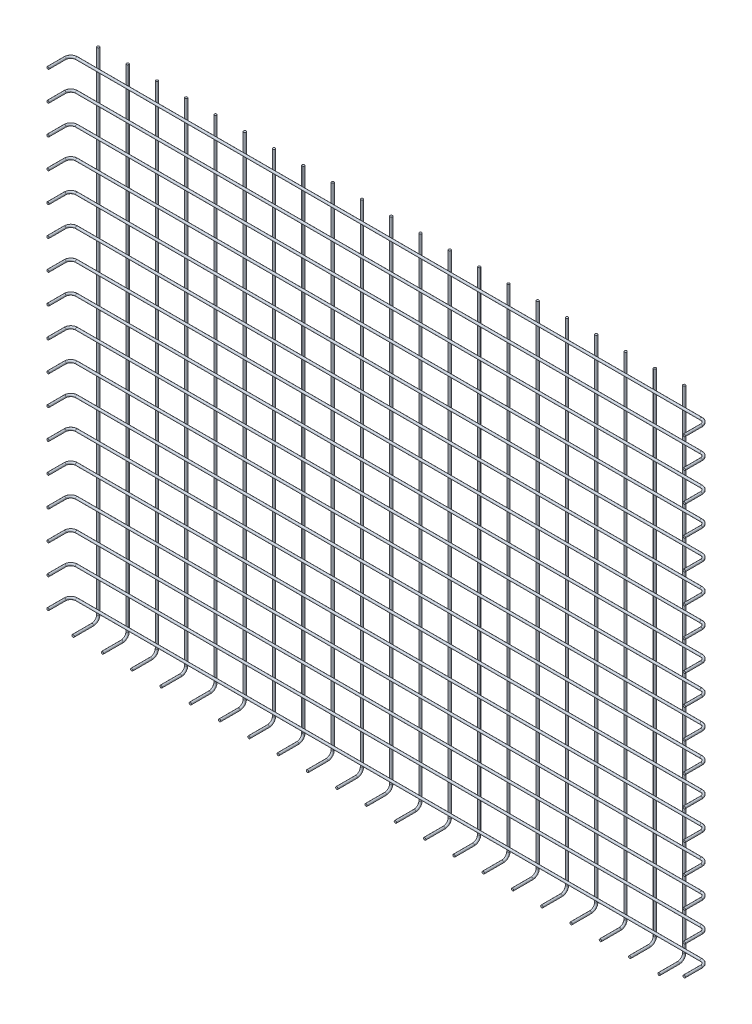
from build123d import *

# Parameters (mm, degrees)
SKETCH_1_R             = 2
PATTERN_LINEAR_1_COUNT = 11
PATTERN_LINEAR_1_PITCH = 50
SKETCH_4_R             = 2
PATTERN_LINEAR_2_COUNT = 17
PATTERN_LINEAR_2_PITCH = 50


with BuildPart() as part:
    # По траектории1: sweep along a path in Эскиз2
    with BuildLine(Plane(origin=(0, 0, 0), x_dir=(0, 0, -1), z_dir=(1, 0, 0))) as sweep_1_path:
        Line((-47, 2), (-14, 2))
        ThreePointArc((-14, 2), (-6.928932188, 4.928932188), (-4, 12))
        Line((-4, 12), (-4, 851.056624327))
    # Эскиз1 → По траектории1 (sweep)
    with BuildSketch(Plane.XY.offset(47)):
        with Locations((0, 2)):
            Circle(SKETCH_1_R)
    sweep(path=sweep_1_path.line)


with BuildPart() as pattern_linear_1_1:
    # Линейный массив1: pattern copy
    add(part.part.moved(Location(Vector(1, 0, 0) * (1 * PATTERN_LINEAR_1_PITCH))))


with BuildPart() as pattern_linear_1_2:
    # Линейный массив1: pattern copy
    add(part.part.moved(Location(Vector(1, 0, 0) * (2 * PATTERN_LINEAR_1_PITCH))))


with BuildPart() as pattern_linear_1_3:
    # Линейный массив1: pattern copy
    add(part.part.moved(Location(Vector(1, 0, 0) * (3 * PATTERN_LINEAR_1_PITCH))))


with BuildPart() as pattern_linear_1_4:
    # Линейный массив1: pattern copy
    add(part.part.moved(Location(Vector(1, 0, 0) * (4 * PATTERN_LINEAR_1_PITCH))))


with BuildPart() as pattern_linear_1_5:
    # Линейный массив1: pattern copy
    add(part.part.moved(Location(Vector(1, 0, 0) * (5 * PATTERN_LINEAR_1_PITCH))))


with BuildPart() as pattern_linear_1_6:
    # Линейный массив1: pattern copy
    add(part.part.moved(Location(Vector(1, 0, 0) * (6 * PATTERN_LINEAR_1_PITCH))))


with BuildPart() as pattern_linear_1_7:
    # Линейный массив1: pattern copy
    add(part.part.moved(Location(Vector(1, 0, 0) * (7 * PATTERN_LINEAR_1_PITCH))))


with BuildPart() as pattern_linear_1_8:
    # Линейный массив1: pattern copy
    add(part.part.moved(Location(Vector(1, 0, 0) * (8 * PATTERN_LINEAR_1_PITCH))))


with BuildPart() as pattern_linear_1_9:
    # Линейный массив1: pattern copy
    add(part.part.moved(Location(Vector(1, 0, 0) * (9 * PATTERN_LINEAR_1_PITCH))))


with BuildPart() as pattern_linear_1_10:
    # Линейный массив1: pattern copy
    add(part.part.moved(Location(Vector(1, 0, 0) * (10 * PATTERN_LINEAR_1_PITCH))))


with BuildPart() as body_12:
    # Зеркальное отражение1: mirrored copy
    add(pattern_linear_1_10.part.mirror(Plane(origin=(0, 0, 0), x_dir=(0, 0, 1), z_dir=(1, 0, 0))))


with BuildPart() as body_13:
    # Mirror 1 2: mirrored copy
    add(pattern_linear_1_9.part.mirror(Plane(origin=(0, 0, 0), x_dir=(0, 0, 1), z_dir=(1, 0, 0))))


with BuildPart() as body_14:
    # Mirror 1 3: mirrored copy
    add(pattern_linear_1_8.part.mirror(Plane(origin=(0, 0, 0), x_dir=(0, 0, 1), z_dir=(1, 0, 0))))


with BuildPart() as body_15:
    # Mirror 1 4: mirrored copy
    add(pattern_linear_1_7.part.mirror(Plane(origin=(0, 0, 0), x_dir=(0, 0, 1), z_dir=(1, 0, 0))))


with BuildPart() as body_16:
    # Mirror 1 5: mirrored copy
    add(pattern_linear_1_6.part.mirror(Plane(origin=(0, 0, 0), x_dir=(0, 0, 1), z_dir=(1, 0, 0))))


with BuildPart() as body_17:
    # Mirror 1 6: mirrored copy
    add(pattern_linear_1_5.part.mirror(Plane(origin=(0, 0, 0), x_dir=(0, 0, 1), z_dir=(1, 0, 0))))


with BuildPart() as body_18:
    # Mirror 1 7: mirrored copy
    add(pattern_linear_1_4.part.mirror(Plane(origin=(0, 0, 0), x_dir=(0, 0, 1), z_dir=(1, 0, 0))))


with BuildPart() as body_19:
    # Mirror 1 8: mirrored copy
    add(pattern_linear_1_3.part.mirror(Plane(origin=(0, 0, 0), x_dir=(0, 0, 1), z_dir=(1, 0, 0))))


with BuildPart() as body_20:
    # Mirror 1 9: mirrored copy
    add(pattern_linear_1_2.part.mirror(Plane(origin=(0, 0, 0), x_dir=(0, 0, 1), z_dir=(1, 0, 0))))


with BuildPart() as body_21:
    # Mirror 1 10: mirrored copy
    add(pattern_linear_1_1.part.mirror(Plane(origin=(0, 0, 0), x_dir=(0, 0, 1), z_dir=(1, 0, 0))))


with BuildPart() as body_22:
    # По траектории2: sweep along a path in Эскиз3
    with BuildLine(Plane(origin=(0, 20, 0), x_dir=(1, 0, 0), z_dir=(0, 1, 0))) as sweep_2_path:
        Line((-543, -47), (-543, -18))
        ThreePointArc((-543, -18), (-540.071067812, -10.928932188), (-533, -8))
        Line((-533, -8), (533, -8))
        ThreePointArc((533, -8), (540.071067812, -10.928932188), (543, -18))
        Line((543, -18), (543, -47))
    # Эскиз4 → По траектории2 (sweep)
    with BuildSketch(Plane.XY.offset(47)):
        with Locations((543, 20)):
            Circle(SKETCH_4_R)
    sweep(path=sweep_2_path.line)


with BuildPart() as pattern_linear_2_1:
    # Линейный массив2: pattern copy
    add(body_22.part.moved(Location(Vector(0, 1, 0) * (1 * PATTERN_LINEAR_2_PITCH))))


with BuildPart() as pattern_linear_2_2:
    # Линейный массив2: pattern copy
    add(body_22.part.moved(Location(Vector(0, 1, 0) * (2 * PATTERN_LINEAR_2_PITCH))))


with BuildPart() as pattern_linear_2_3:
    # Линейный массив2: pattern copy
    add(body_22.part.moved(Location(Vector(0, 1, 0) * (3 * PATTERN_LINEAR_2_PITCH))))


with BuildPart() as pattern_linear_2_4:
    # Линейный массив2: pattern copy
    add(body_22.part.moved(Location(Vector(0, 1, 0) * (4 * PATTERN_LINEAR_2_PITCH))))


with BuildPart() as pattern_linear_2_5:
    # Линейный массив2: pattern copy
    add(body_22.part.moved(Location(Vector(0, 1, 0) * (5 * PATTERN_LINEAR_2_PITCH))))


with BuildPart() as pattern_linear_2_6:
    # Линейный массив2: pattern copy
    add(body_22.part.moved(Location(Vector(0, 1, 0) * (6 * PATTERN_LINEAR_2_PITCH))))


with BuildPart() as pattern_linear_2_7:
    # Линейный массив2: pattern copy
    add(body_22.part.moved(Location(Vector(0, 1, 0) * (7 * PATTERN_LINEAR_2_PITCH))))


with BuildPart() as pattern_linear_2_8:
    # Линейный массив2: pattern copy
    add(body_22.part.moved(Location(Vector(0, 1, 0) * (8 * PATTERN_LINEAR_2_PITCH))))


with BuildPart() as pattern_linear_2_9:
    # Линейный массив2: pattern copy
    add(body_22.part.moved(Location(Vector(0, 1, 0) * (9 * PATTERN_LINEAR_2_PITCH))))


with BuildPart() as pattern_linear_2_10:
    # Линейный массив2: pattern copy
    add(body_22.part.moved(Location(Vector(0, 1, 0) * (10 * PATTERN_LINEAR_2_PITCH))))


with BuildPart() as pattern_linear_2_11:
    # Линейный массив2: pattern copy
    add(body_22.part.moved(Location(Vector(0, 1, 0) * (11 * PATTERN_LINEAR_2_PITCH))))


with BuildPart() as pattern_linear_2_12:
    # Линейный массив2: pattern copy
    add(body_22.part.moved(Location(Vector(0, 1, 0) * (12 * PATTERN_LINEAR_2_PITCH))))


with BuildPart() as pattern_linear_2_13:
    # Линейный массив2: pattern copy
    add(body_22.part.moved(Location(Vector(0, 1, 0) * (13 * PATTERN_LINEAR_2_PITCH))))


with BuildPart() as pattern_linear_2_14:
    # Линейный массив2: pattern copy
    add(body_22.part.moved(Location(Vector(0, 1, 0) * (14 * PATTERN_LINEAR_2_PITCH))))


with BuildPart() as pattern_linear_2_15:
    # Линейный массив2: pattern copy
    add(body_22.part.moved(Location(Vector(0, 1, 0) * (15 * PATTERN_LINEAR_2_PITCH))))


with BuildPart() as pattern_linear_2_16:
    # Линейный массив2: pattern copy
    add(body_22.part.moved(Location(Vector(0, 1, 0) * (16 * PATTERN_LINEAR_2_PITCH))))


solid = Compound([part.part, pattern_linear_1_1.part, pattern_linear_1_2.part, pattern_linear_1_3.part, pattern_linear_1_4.part, pattern_linear_1_5.part, pattern_linear_1_6.part, pattern_linear_1_7.part, pattern_linear_1_8.part, pattern_linear_1_9.part, pattern_linear_1_10.part, body_12.part, body_13.part, body_14.part, body_15.part, body_16.part, body_17.part, body_18.part, body_19.part, body_20.part, body_21.part, body_22.part, pattern_linear_2_1.part, pattern_linear_2_2.part, pattern_linear_2_3.part, pattern_linear_2_4.part, pattern_linear_2_5.part, pattern_linear_2_6.part, pattern_linear_2_7.part, pattern_linear_2_8.part, pattern_linear_2_9.part, pattern_linear_2_10.part, pattern_linear_2_11.part, pattern_linear_2_12.part, pattern_linear_2_13.part, pattern_linear_2_14.part, pattern_linear_2_15.part, pattern_linear_2_16.part])
